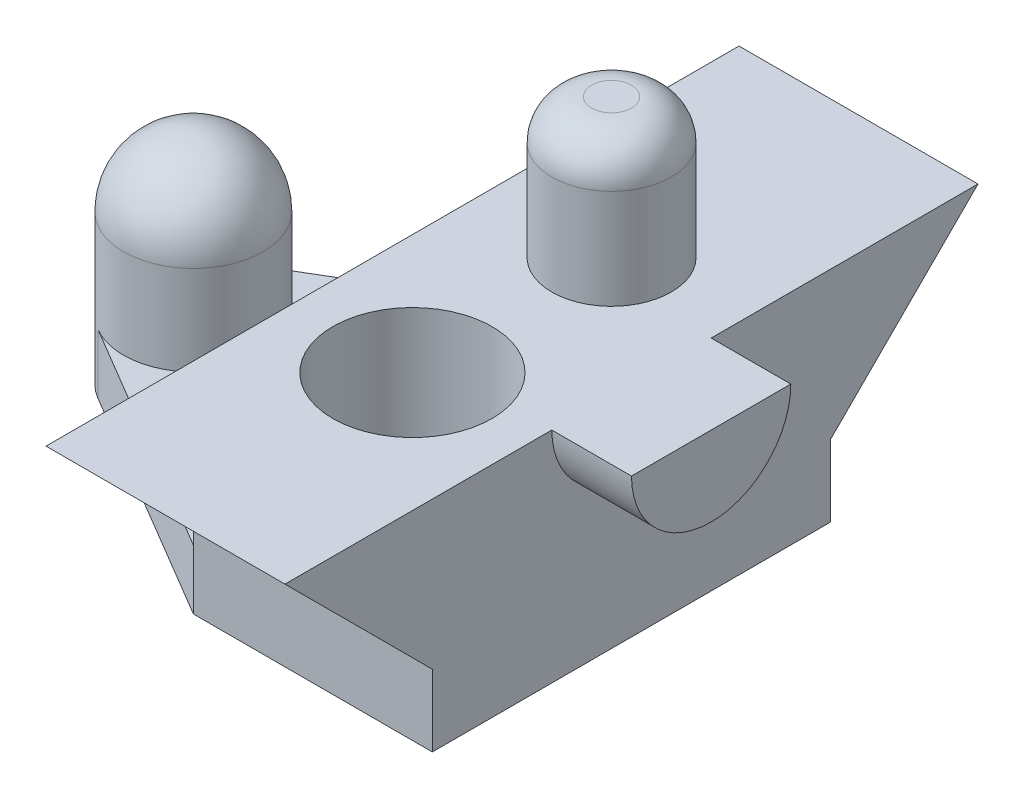
from build123d import *

# Parameters (mm, degrees)
BOSS_EXTRUDE1_DEPTH = 1.5
BOSS_EXTRUDE2_START = 4
SKETCH2_R           = 1.75
SKETCH2_W           = 6
SKETCH2_H           = 10
BOSS_EXTRUDE2_DEPTH = 4
FILLET1_R           = 1.75
SKETCH4_R           = 1.5
BOSS_EXTRUDE4_DEPTH = 3.5
FILLET2_R           = 1
SKETCH5_R           = 2
CUT_EXTRUDE1_DEPTH  = 3.75
BOSS_EXTRUDE5_DEPTH = 2
BOSS_EXTRUDE6_DEPTH = 6


with BuildPart() as part:
    # Sketch1 → Boss-Extrude1 (new body)
    with BuildSketch(Plane(origin=(0, 0, 0), x_dir=(1, 0, 0), z_dir=(0, 1, 0))):
        with BuildLine():
            Line((5, 5), (11, 5))
            Line((11, 5), (11, -5))
            Line((11, -5), (5, -5))
            Line((5, -5), (-0.892691591, -1.505191591))
            ThreePointArc((-0.892691591, -1.505191591), (-1.75, 0), (-0.892691591, 1.505191591))
            Line((-0.892691591, 1.505191591), (5, 5))
        make_face()
    extrude(amount=-BOSS_EXTRUDE1_DEPTH)

    # Sketch2 → Boss-Extrude2 (add)
    with BuildSketch(Plane(origin=(0, 0, 0), x_dir=(1, 0, 0), z_dir=(0, 1, 0)).offset(BOSS_EXTRUDE2_START)):
        with Locations(Location((0, 0, 0), (0, 0, 270))):
            Circle(SKETCH2_R)
        with Locations((8, 0)):
            Rectangle(SKETCH2_W, SKETCH2_H)
    extrude(amount=-BOSS_EXTRUDE2_DEPTH)

    # Fillet1
    fillet1_edges = [part.edges().sort_by_distance(p)[0] for p in [
        (0, 4, -1.75),
    ]]
    fillet(fillet1_edges, radius=FILLET1_R)

    # Sketch4 → Boss-Extrude4 (add)
    with BuildSketch(Plane(origin=(0, 4, 0), x_dir=(1, 0, 0), z_dir=(0, 1, 0))):
        with Locations(Location((8, 2.5, 0), (0, 0, 270))):
            Circle(SKETCH4_R)
    extrude(amount=BOSS_EXTRUDE4_DEPTH)

    # Fillet2
    fillet2_edges = [part.edges().sort_by_distance(p)[0] for p in [
        (8, 7.5, -4),
    ]]
    fillet(fillet2_edges, radius=FILLET2_R)

    # Sketch5 → Cut-Extrude1 (cut)
    with BuildSketch(Plane(origin=(0, 4, 0), x_dir=(1, 0, 0), z_dir=(0, 1, 0))):
        with Locations(Location((8, -2.5, 0), (0, 0, 270))):
            Circle(SKETCH5_R)
    extrude(amount=-CUT_EXTRUDE1_DEPTH, mode=Mode.SUBTRACT)

    # Sketch6 → Boss-Extrude5 (add)
    with BuildSketch(Plane(origin=(11, 0, 0), x_dir=(0, 0, -1), z_dir=(1, 0, 0))):
        with BuildLine():
            Line((-2, 4), (2, 4))
            ThreePointArc((2, 4), (0, 2), (-2, 4))
        make_face()
    extrude(amount=BOSS_EXTRUDE5_DEPTH)

    # Sketch9 → Boss-Extrude6 (add)
    with BuildSketch(Plane(origin=(11, 0, 0), x_dir=(0, 0, -1), z_dir=(1, 0, 0))):
        Polygon((-5, 4), (-8.7, 4), (-5, 0.3), align=None)
        Polygon((5, 0.3), (5, 4), (8.7, 4), align=None)
    extrude(amount=-BOSS_EXTRUDE6_DEPTH)


solid = part.part
